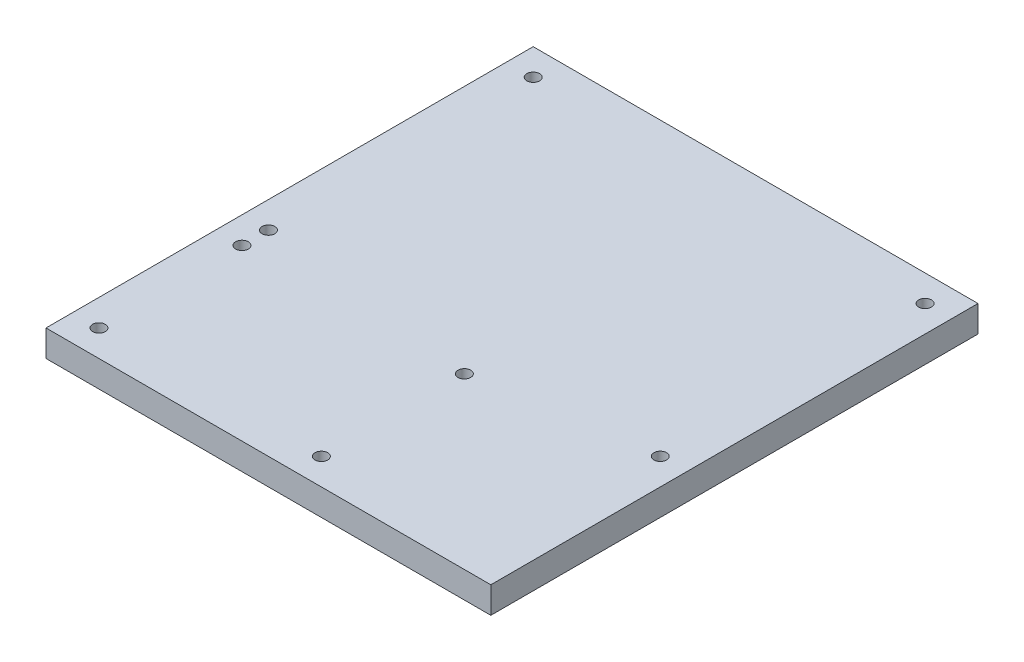
from build123d import *

# Parameters (mm, degrees)
SKETCH_1_W          = 84
SKETCH_1_H          = 92
EXTRUDE_1_DEPTH     = 5
SKETCH_2_W          = 25
SKETCH_2_H          = 25
SKETCH_2_W_2        = 15
SKETCH_2_H_2        = 15
SKETCH_2_W_3        = 5.1
SKETCH_2_H_3        = 5
EXTRUDE_2_DEPTH     = 10
SKETCH_3_R          = 1.2
CUT_EXTRUDE_1_DEPTH = 10


with BuildPart() as part:
    # 草图1 → 凸台-拉伸1 (new body)
    with BuildSketch(Plane(origin=(0, 0, 0), x_dir=(1, 0, 0), z_dir=(0, 1, 0))):
        Rectangle(SKETCH_1_W, SKETCH_1_H)
    extrude(amount=EXTRUDE_1_DEPTH)

    # 草图2 → 凸台-拉伸2 (add)
    # profile 1 of 2: a face of its own
    with BuildSketch(Plane.XZ):
        Rectangle(SKETCH_2_W, SKETCH_2_H)
        Rectangle(SKETCH_2_W_2, SKETCH_2_H_2, mode=Mode.SUBTRACT)
    # profile 2 of 2: a face of its own
    with BuildSketch(Plane.XZ):
        Rectangle(SKETCH_2_W_3, SKETCH_2_H_3)
    extrude(amount=EXTRUDE_2_DEPTH)

    # 草图3 → 切除-拉伸1 (cut)
    with BuildSketch(Plane(origin=(0, 5, 0), x_dir=(1, 0, 0), z_dir=(0, 1, 0))):
        with Locations(Location((-37, -14, 0), (0, 0, 270))):
            Circle(SKETCH_3_R)
        with Locations(Location((5, -14, 0), (0, 0, 270))):
            Circle(SKETCH_3_R)
        with Locations(Location((-37, -41, 0), (0, 0, 270))):
            Circle(SKETCH_3_R)
        with Locations(Location((5, -41, 0), (0, 0, 270))):
            Circle(SKETCH_3_R)
        with Locations(Location((37, -9, 0), (0, 0, 270))):
            Circle(SKETCH_3_R)
        with Locations(Location((-37, -9, 0), (0, 0, 270))):
            Circle(SKETCH_3_R)
        with Locations(Location((-37, 41, 0), (0, 0, 270))):
            Circle(SKETCH_3_R)
        with Locations(Location((37, 41, 0), (0, 0, 270))):
            Circle(SKETCH_3_R)
    extrude(amount=-CUT_EXTRUDE_1_DEPTH, mode=Mode.SUBTRACT)


solid = part.part
